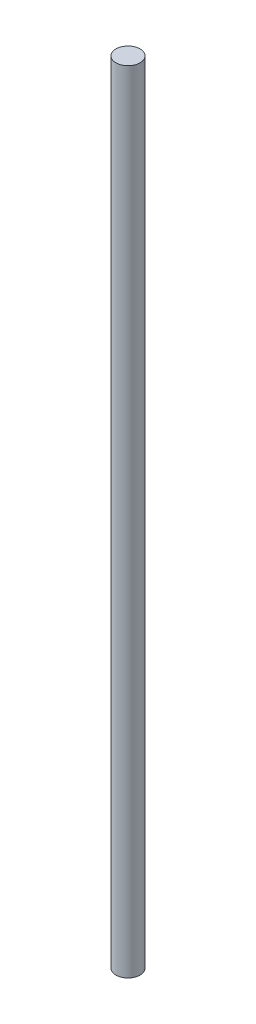
from build123d import *

# Parameters (mm, degrees)
SKETCH1_R           = 0.55
BOSS_EXTRUDE1_DEPTH = 36


with BuildPart() as part:
    # Sketch1 → Boss-Extrude1 (new body)
    with BuildSketch(Plane(origin=(0, 0, 0), x_dir=(1, 0, 0), z_dir=(0, 1, 0))):
        with Locations(Location((0, 0, 0), (0, 0, 270))):
            Circle(SKETCH1_R)
    extrude(amount=BOSS_EXTRUDE1_DEPTH)


solid = part.part
